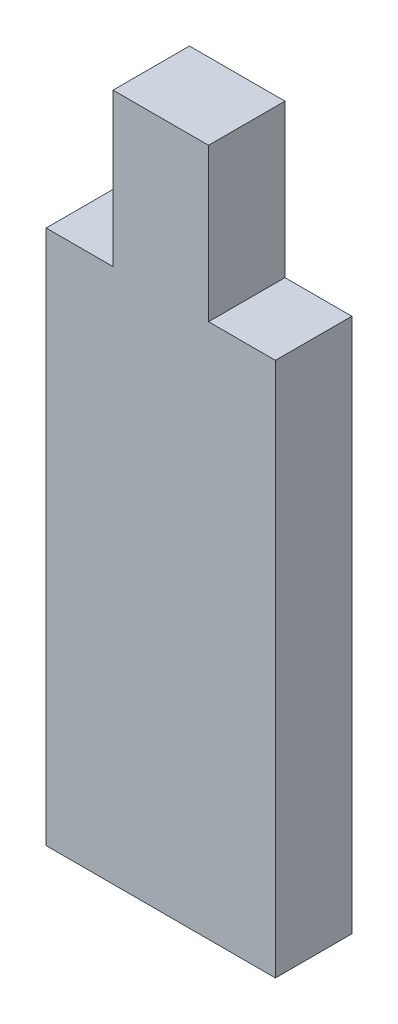
from build123d import *

# Parameters (mm, degrees)
BOSS_EXTRUDE1_DEPTH = 4


with BuildPart() as part:
    # Sketch1 → Boss-Extrude1 (new body)
    with BuildSketch(Plane.XY):
        Polygon((0, 0), (0, 28), (3.5, 28), (3.5, 36), (8.5, 36), (8.5, 28), (12, 28), (12, 0), align=None)
    extrude(amount=BOSS_EXTRUDE1_DEPTH)


solid = part.part
